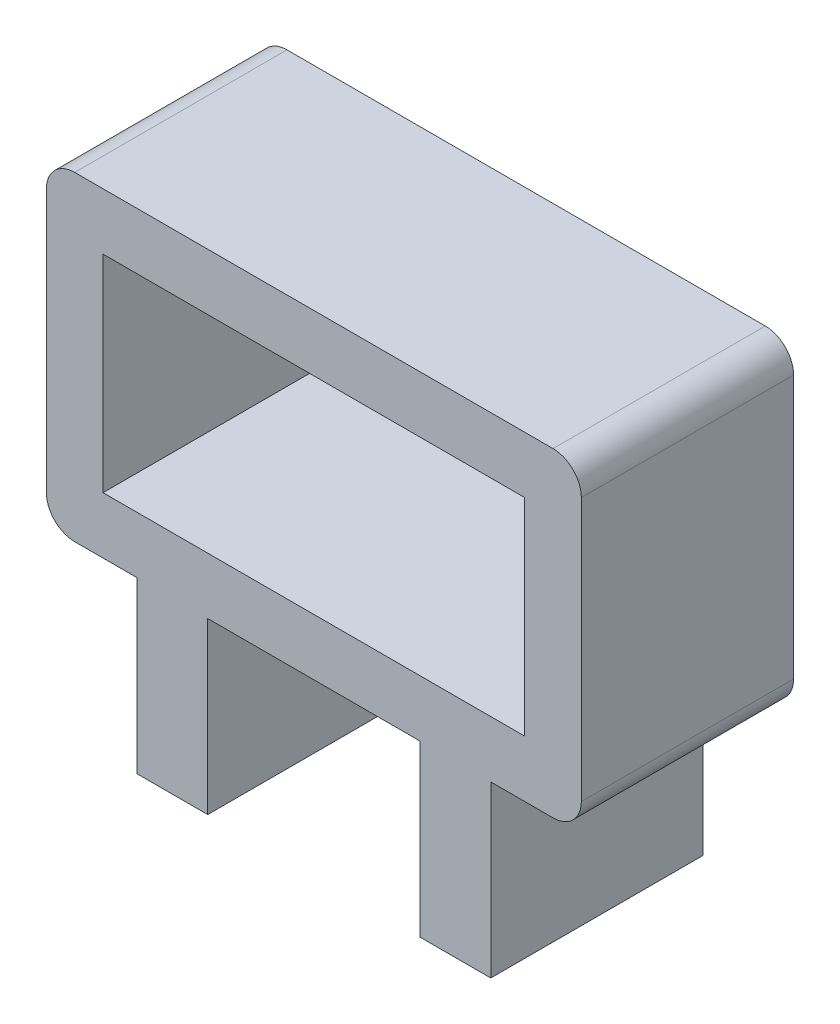
from build123d import *

# Parameters (mm, degrees)
SKETCH1_W           = 29.8
SKETCH1_H           = 14.6
BOSS_EXTRUDE1_DEPTH = 15
FILLET1_R           = 2


with BuildPart() as part:
    # Sketch1 → Boss-Extrude1 (new body)
    with BuildSketch(Plane.XY):
        Polygon((-36.104717196, 20.437010324), (1.695282804, 20.437010324), (1.695282804, -2.162989676), (-4.704717196, -2.162989676), (-4.704717196, -14.162989676), (-9.704717196, -14.162989676), (-9.704717196, -2.162989676), (-24.704717196, -2.162989676), (-24.704717196, -14.162989676), (-29.704717196, -14.162989676), (-29.704717196, -2.162989676), (-36.104717196, -2.162989676), align=None)
        with Locations((-17.204717196, 9.137010324)):
            Rectangle(SKETCH1_W, SKETCH1_H, mode=Mode.SUBTRACT)
    extrude(amount=BOSS_EXTRUDE1_DEPTH)

    # Fillet1
    fillet1_edges = [part.edges().sort_by_distance(p)[0] for p in [
        (-36.104717196, -2.162989676, 7.5),
        (-36.104717196, 20.437010324, 7.5),
        (1.695282804, 20.437010324, 7.5),
        (1.695282804, -2.162989676, 7.5),
    ]]
    fillet(fillet1_edges, radius=FILLET1_R)


solid = part.part
